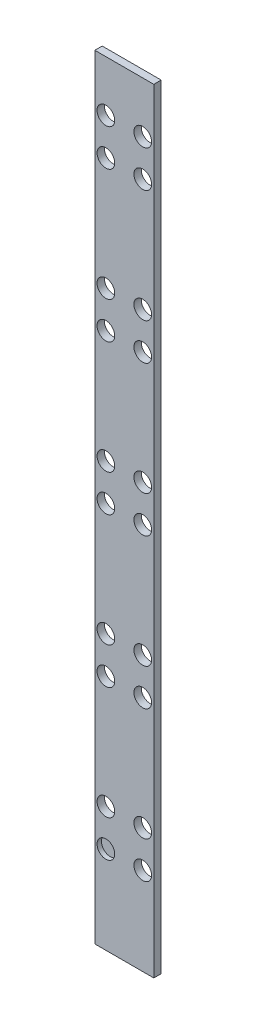
from build123d import *

# Parameters (mm, degrees)
SKETCH3_W           = 4
SKETCH3_H           = 0.5
BOSS_EXTRUDE1_DEPTH = 52.5
SKETCH4_R           = 0.6
CUT_EXTRUDE1_DEPTH  = 0.5
SKETCH5_R           = 0.6
CUT_EXTRUDE2_DEPTH  = 0.5
SKETCH6_R           = 0.6
CUT_EXTRUDE3_DEPTH  = 0.5
SKETCH7_R           = 0.6
CUT_EXTRUDE4_DEPTH  = 0.5
SKETCH8_R           = 0.6
CUT_EXTRUDE5_DEPTH  = 0.5
SKETCH9_R           = 0.6
CUT_EXTRUDE6_DEPTH  = 0.5
SKETCH10_R          = 0.6
CUT_EXTRUDE7_DEPTH  = 0.5
SKETCH11_R          = 0.6
CUT_EXTRUDE8_DEPTH  = 0.5
SKETCH12_R          = 0.6
CUT_EXTRUDE9_DEPTH  = 0.5
SKETCH13_R          = 0.6
CUT_EXTRUDE10_DEPTH = 0.5
SKETCH14_R          = 0.6
CUT_EXTRUDE11_DEPTH = 0.5
SKETCH15_R          = 0.6
CUT_EXTRUDE12_DEPTH = 0.5
SKETCH16_R          = 0.6
CUT_EXTRUDE13_DEPTH = 0.5
SKETCH17_R          = 0.6
CUT_EXTRUDE14_DEPTH = 0.5
SKETCH18_R          = 0.6
CUT_EXTRUDE15_DEPTH = 0.5
SKETCH19_R          = 0.6
CUT_EXTRUDE16_DEPTH = 0.5
SKETCH20_R          = 0.6
CUT_EXTRUDE17_DEPTH = 0.5
SKETCH21_R          = 0.6
CUT_EXTRUDE18_DEPTH = 0.5
SKETCH22_R          = 0.6
CUT_EXTRUDE19_DEPTH = 0.5
SKETCH23_R          = 0.6
CUT_EXTRUDE20_DEPTH = 0.3


with BuildPart() as part:
    # Sketch3 → Boss-Extrude1 (new body)
    with BuildSketch(Plane(origin=(0, 0, 0), x_dir=(1, 0, 0), z_dir=(0, 1, 0))):
        with Locations((0, 0.1)):
            Rectangle(SKETCH3_W, SKETCH3_H)
    extrude(amount=-BOSS_EXTRUDE1_DEPTH)

    # Sketch4 → Cut-Extrude1 (cut)
    with BuildSketch(Plane.XY.offset(0.15)):
        with Locations((1.25, -3.45)):
            Circle(SKETCH4_R)
    extrude(amount=-CUT_EXTRUDE1_DEPTH, mode=Mode.SUBTRACT)

    # Sketch5 → Cut-Extrude2 (cut)
    with BuildSketch(Plane.XY.offset(0.15)):
        with Locations((1.25, -5.95)):
            Circle(SKETCH5_R)
    extrude(amount=-CUT_EXTRUDE2_DEPTH, mode=Mode.SUBTRACT)

    # Sketch6 → Cut-Extrude3 (cut)
    with BuildSketch(Plane.XY.offset(0.15)):
        with Locations((1.25, -13.6)):
            Circle(SKETCH6_R)
    extrude(amount=-CUT_EXTRUDE3_DEPTH, mode=Mode.SUBTRACT)

    # Sketch7 → Cut-Extrude4 (cut)
    with BuildSketch(Plane.XY.offset(0.15)):
        with Locations((1.25, -16.1)):
            Circle(SKETCH7_R)
    extrude(amount=-CUT_EXTRUDE4_DEPTH, mode=Mode.SUBTRACT)

    # Sketch8 → Cut-Extrude5 (cut)
    with BuildSketch(Plane.XY.offset(0.15)):
        with Locations((1.25, -23.75)):
            Circle(SKETCH8_R)
    extrude(amount=-CUT_EXTRUDE5_DEPTH, mode=Mode.SUBTRACT)

    # Sketch9 → Cut-Extrude6 (cut)
    with BuildSketch(Plane.XY.offset(0.15)):
        with Locations((1.25, -26.25)):
            Circle(SKETCH9_R)
    extrude(amount=-CUT_EXTRUDE6_DEPTH, mode=Mode.SUBTRACT)

    # Sketch10 → Cut-Extrude7 (cut)
    with BuildSketch(Plane.XY.offset(0.15)):
        with Locations((1.25, -33.9)):
            Circle(SKETCH10_R)
    extrude(amount=-CUT_EXTRUDE7_DEPTH, mode=Mode.SUBTRACT)

    # Sketch11 → Cut-Extrude8 (cut)
    with BuildSketch(Plane.XY.offset(0.15)):
        with Locations((1.25, -36.4)):
            Circle(SKETCH11_R)
    extrude(amount=-CUT_EXTRUDE8_DEPTH, mode=Mode.SUBTRACT)

    # Sketch12 → Cut-Extrude9 (cut)
    with BuildSketch(Plane.XY.offset(0.15)):
        with Locations((1.25, -44.05)):
            Circle(SKETCH12_R)
    extrude(amount=-CUT_EXTRUDE9_DEPTH, mode=Mode.SUBTRACT)

    # Sketch13 → Cut-Extrude10 (cut)
    with BuildSketch(Plane.XY.offset(0.15)):
        with Locations((1.25, -46.55)):
            Circle(SKETCH13_R)
    extrude(amount=-CUT_EXTRUDE10_DEPTH, mode=Mode.SUBTRACT)

    # Sketch14 → Cut-Extrude11 (cut)
    with BuildSketch(Plane.XY.offset(0.15)):
        with Locations((-1.25, -3.45)):
            Circle(SKETCH14_R)
    extrude(amount=-CUT_EXTRUDE11_DEPTH, mode=Mode.SUBTRACT)

    # Sketch15 → Cut-Extrude12 (cut)
    with BuildSketch(Plane.XY.offset(0.15)):
        with Locations((-1.25, -5.95)):
            Circle(SKETCH15_R)
    extrude(amount=-CUT_EXTRUDE12_DEPTH, mode=Mode.SUBTRACT)

    # Sketch16 → Cut-Extrude13 (cut)
    with BuildSketch(Plane.XY.offset(0.15)):
        with Locations((-1.25, -13.6)):
            Circle(SKETCH16_R)
    extrude(amount=-CUT_EXTRUDE13_DEPTH, mode=Mode.SUBTRACT)

    # Sketch17 → Cut-Extrude14 (cut)
    with BuildSketch(Plane.XY.offset(0.15)):
        with Locations((-1.25, -16.1)):
            Circle(SKETCH17_R)
    extrude(amount=-CUT_EXTRUDE14_DEPTH, mode=Mode.SUBTRACT)

    # Sketch18 → Cut-Extrude15 (cut)
    with BuildSketch(Plane.XY.offset(0.15)):
        with Locations((-1.25, -23.75)):
            Circle(SKETCH18_R)
    extrude(amount=-CUT_EXTRUDE15_DEPTH, mode=Mode.SUBTRACT)

    # Sketch19 → Cut-Extrude16 (cut)
    with BuildSketch(Plane.XY.offset(0.15)):
        with Locations((-1.25, -26.25)):
            Circle(SKETCH19_R)
    extrude(amount=-CUT_EXTRUDE16_DEPTH, mode=Mode.SUBTRACT)

    # Sketch20 → Cut-Extrude17 (cut)
    with BuildSketch(Plane.XY.offset(0.15)):
        with Locations((-1.25, -33.9)):
            Circle(SKETCH20_R)
    extrude(amount=-CUT_EXTRUDE17_DEPTH, mode=Mode.SUBTRACT)

    # Sketch21 → Cut-Extrude18 (cut)
    with BuildSketch(Plane.XY.offset(0.15)):
        with Locations((-1.25, -36.4)):
            Circle(SKETCH21_R)
    extrude(amount=-CUT_EXTRUDE18_DEPTH, mode=Mode.SUBTRACT)

    # Sketch22 → Cut-Extrude19 (cut)
    with BuildSketch(Plane.XY.offset(0.15)):
        with Locations((-1.25, -44.05)):
            Circle(SKETCH22_R)
    extrude(amount=-CUT_EXTRUDE19_DEPTH, mode=Mode.SUBTRACT)

    # Sketch23 → Cut-Extrude20 (cut)
    with BuildSketch(Plane.XY.offset(0.15)):
        with Locations((-1.25, -46.55)):
            Circle(SKETCH23_R)
    extrude(amount=-CUT_EXTRUDE20_DEPTH, mode=Mode.SUBTRACT)


solid = part.part
